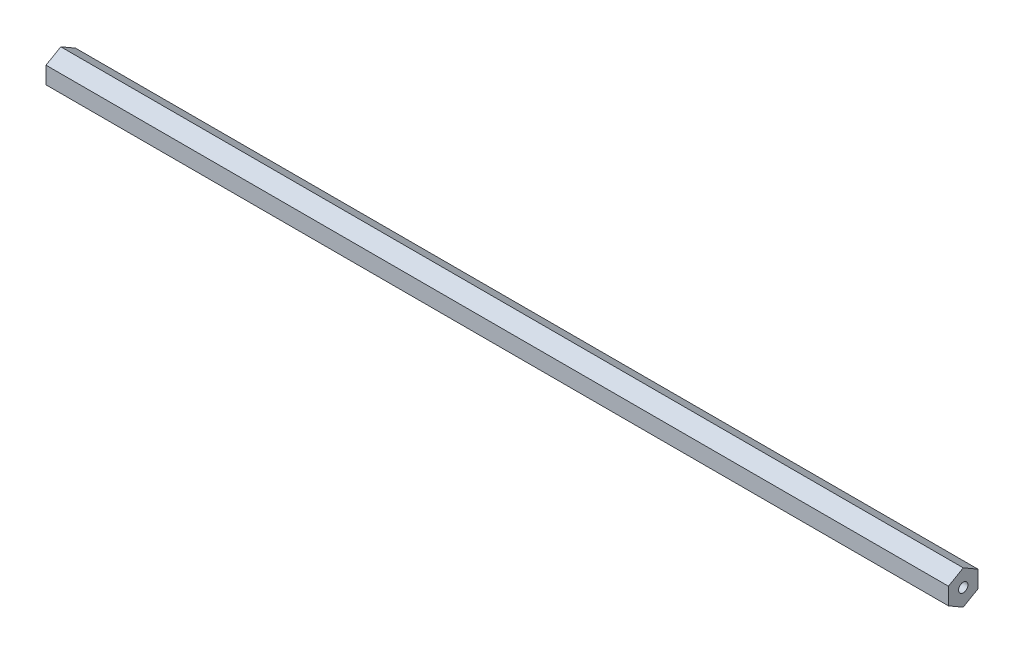
from build123d import *

# Parameters (mm, degrees)
BOSS_EXTRUDE1_DEPTH                  = 194.071875
F_10_32_TAPPED_HOLE1_D               = 4.0386
F_10_32_TAPPED_HOLE1_DEPTH           = 16.34744
F_10_32_TAPPED_HOLE1_TIP             = 1.213317848
F_10_32_TAPPED_HOLE1_ON_FACE_2_D     = 4.0386
F_10_32_TAPPED_HOLE1_ON_FACE_2_DEPTH = 16.34744
F_10_32_TAPPED_HOLE1_ON_FACE_2_TIP   = 1.213317848


with BuildPart() as part:
    # Sketch1 → Boss-Extrude1 (new, symmetric)
    with BuildSketch(Plane(origin=(0, 0, 0), x_dir=(0, 0, -1), z_dir=(1, 0, 0))):
        Polygon((0, 7.332348419), (-6.35, 3.666174209), (-6.35, -3.666174209), (0, -7.332348419), (6.35, -3.666174209), (6.35, 3.666174209), align=None)
    extrude(amount=BOSS_EXTRUDE1_DEPTH, both=True)

    # #10-32 Tapped Hole1
    with Locations(Plane(origin=(194.071875, 0, 0), x_dir=(0, 0, 1), z_dir=(1, 0, 0))):
        with Locations((0, 0)):
            Hole(F_10_32_TAPPED_HOLE1_D / 2, depth=F_10_32_TAPPED_HOLE1_DEPTH)
            with Locations((0, 0, -(F_10_32_TAPPED_HOLE1_DEPTH + F_10_32_TAPPED_HOLE1_TIP / 2))):  # 118° drill point
                Cone(0, F_10_32_TAPPED_HOLE1_D / 2, F_10_32_TAPPED_HOLE1_TIP, mode=Mode.SUBTRACT)

    # #10-32 Tapped Hole1 on face 2
    with Locations(Plane(origin=(-194.071875, 0, 0), x_dir=(0, 0, -1), z_dir=(-1, 0, 0))):
        with Locations((0, 0)):
            Hole(F_10_32_TAPPED_HOLE1_ON_FACE_2_D / 2, depth=F_10_32_TAPPED_HOLE1_ON_FACE_2_DEPTH)
            with Locations((0, 0, -(F_10_32_TAPPED_HOLE1_ON_FACE_2_DEPTH + F_10_32_TAPPED_HOLE1_ON_FACE_2_TIP / 2))):  # 118° drill point
                Cone(0, F_10_32_TAPPED_HOLE1_ON_FACE_2_D / 2, F_10_32_TAPPED_HOLE1_ON_FACE_2_TIP, mode=Mode.SUBTRACT)


solid = part.part
